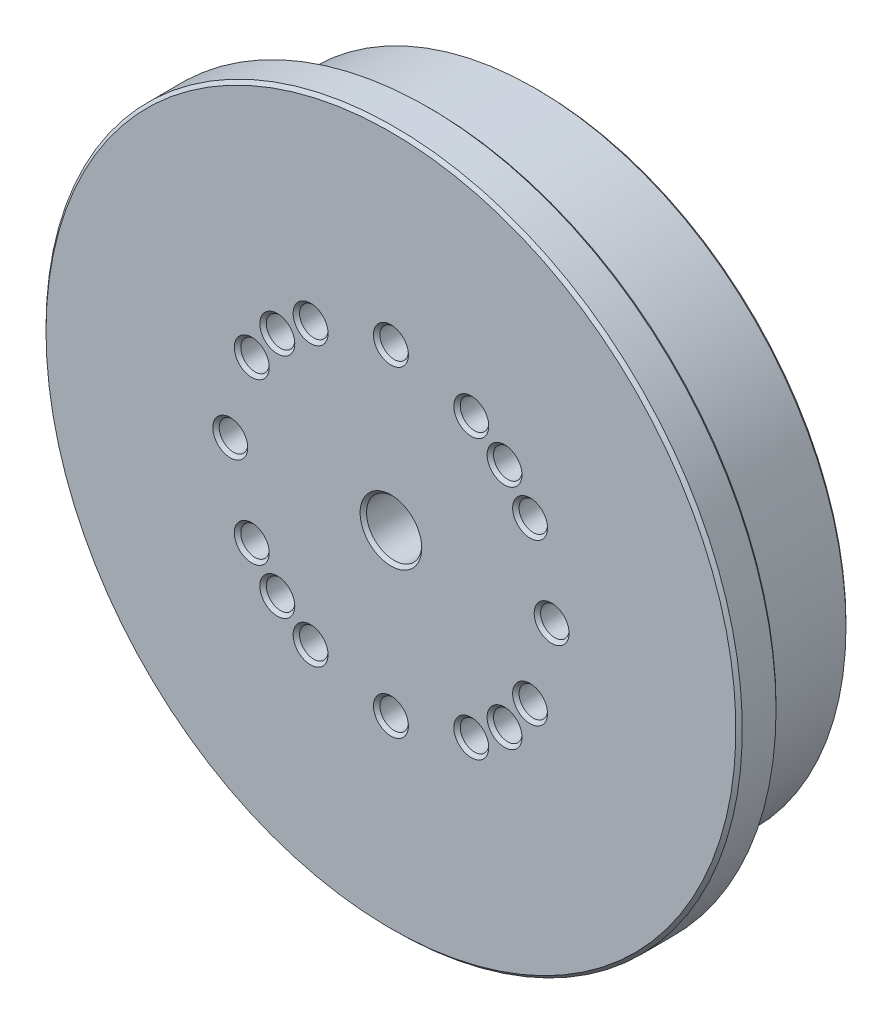
from build123d import *

# Parameters (mm, degrees)
SKETCH1_R               = 73.7362
MAIN_DEPTH              = 25.4
SKETCH2_R               = 82.55
SHOULDER_DEPTH          = 9.525
F_1_4_CLEARANCE_HOLE1_D = 6.7564
F_1_2_CLEARANCE_HOLE1_D = 13.09624
CHAMFER1_SIZE           = 0.762


with BuildPart() as part:
    # Sketch1 → Main (new body)
    with BuildSketch(Plane.XY):
        Circle(SKETCH1_R)
    extrude(amount=MAIN_DEPTH)

    # Sketch2 → Shoulder (add)
    with BuildSketch(Plane.XY.offset(25.4)):
        with Locations(Location((0, 0, 0), (0, 0, 180))):
            Circle(SKETCH2_R)
    extrude(amount=SHOULDER_DEPTH)

    # 1/4 Clearance Hole1 (through all)
    with Locations(Plane.XY.offset(34.925)):
        with Locations((26.940768363, 26.940768363), (0, 38.1), (38.1, 0), (0, -38.1), (-38.1, 0), (26.940768363, -26.940768363), (-26.940768363, -26.940768363), (-26.940768363, 26.940768363), (-19.05, 32.995567884), (19.05, 32.995567884), (32.995567884, 19.05), (-32.995567884, 19.05), (-32.995567884, -19.05), (-19.05, -32.995567884), (19.05, -32.995567884), (32.995567884, -19.05)):
            Hole(F_1_4_CLEARANCE_HOLE1_D / 2)

    # 1/2 Clearance Hole1 (through all)
    with Locations(Plane.XY.offset(34.925)):
        with Locations((0, 0), (124.453596133, 85.444632909)):
            Hole(F_1_2_CLEARANCE_HOLE1_D / 2)

    # Chamfer1
    chamfer1_edges = [part.edges().sort_by_distance(p)[0] for p in [
        (30.318968363, -26.940768363, 0),
        (-34.7218, 0, 34.925),
        (-34.7218, 0, 0),
        (3.3782, -38.1, 34.925),
        (3.3782, -38.1, 0),
        (41.4782, 0, 34.925),
        (41.4782, 0, 0),
        (3.3782, 38.1, 34.925),
        (3.3782, 38.1, 0),
        (6.54812, 0, 34.925),
        (6.54812, 0, 0),
        (-73.7362, 0, 0),
        (30.318968363, 26.940768363, 34.925),
        (30.318968363, 26.940768363, 0),
        (36.373767884, -19.05, 34.925),
        (36.373767884, -19.05, 0),
        (22.4282, -32.995567884, 34.925),
        (22.4282, -32.995567884, 0),
        (-15.6718, -32.995567884, 34.925),
        (-15.6718, -32.995567884, 0),
        (-29.617367884, -19.05, 34.925),
        (-29.617367884, -19.05, 0),
        (-29.617367884, 19.05, 34.925),
        (-29.617367884, 19.05, 0),
        (82.55, 0, 25.4),
        (82.55, 0, 34.925),
        (36.373767884, 19.05, 34.925),
        (36.373767884, 19.05, 0),
        (22.4282, 32.995567884, 34.925),
        (22.4282, 32.995567884, 0),
        (-15.6718, 32.995567884, 34.925),
        (-15.6718, 32.995567884, 0),
        (-23.562568363, 26.940768363, 34.925),
        (-23.562568363, 26.940768363, 0),
        (-23.562568363, -26.940768363, 34.925),
        (-23.562568363, -26.940768363, 0),
        (30.318968363, -26.940768363, 34.925),
    ]]
    chamfer(chamfer1_edges, length=CHAMFER1_SIZE)


solid = part.part
